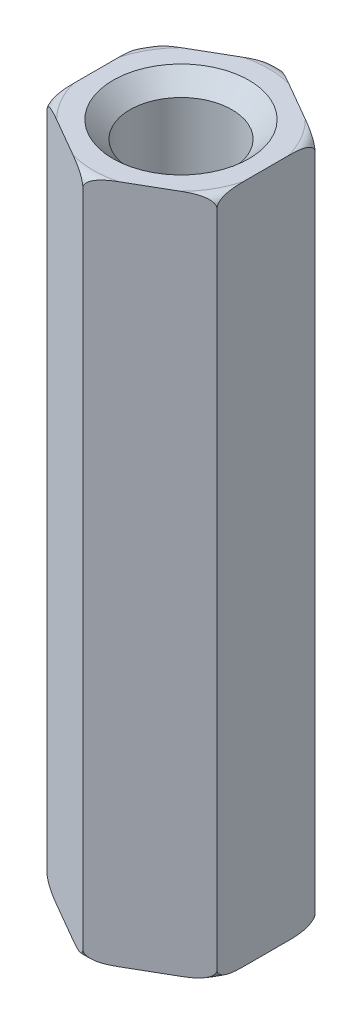
from build123d import *

# Parameters (mm, degrees)
SKETCH2_R           = 1.5
BOSS_EXTRUDE2_DEPTH = 10
CHAMFER1_SIZE       = 0.5


with BuildPart() as part:
    # Sketch2 → Boss-Extrude2 (new, symmetric)
    with BuildSketch(Plane(origin=(0, 0, 0), x_dir=(1, 0, 0), z_dir=(0, 1, 0))):
        Polygon((0, -2.886751346), (2.5, -1.443375673), (2.5, 1.443375673), (0, 2.886751346), (-2.5, 1.443375673), (-2.5, -1.443375673), align=None)
        with Locations(Location((0, 0, 0), (0, 0, 270))):
            Circle(SKETCH2_R, mode=Mode.SUBTRACT)
    extrude(amount=BOSS_EXTRUDE2_DEPTH, both=True)

    # Chamfer1
    chamfer1_edges = [part.edges().sort_by_distance(p)[0] for p in [
        (0, -10, -1.5),
        (0, 10, -1.5),
    ]]
    chamfer(chamfer1_edges, length=CHAMFER1_SIZE)

    # Sketch4 → Cut-Revolve1 (revolve, cut)
    with BuildSketch(Plane(origin=(0, 0, 0), x_dir=(0, 0, -1), z_dir=(1, 0, 0))):
        with BuildLine():
            Line((-2.886751346, 9.7), (-2.886751346, 10))
            Line((-2.886751346, 10), (-2.586751346, 10))
            ThreePointArc((-2.586751346, 10), (-2.79888338, 9.912132034), (-2.886751346, 9.7))
        make_face()
    cut_revolve1 = revolve(axis=Axis((0, 57.75, 0), (0, -1, 0)), mode=Mode.SUBTRACT)

    # Mirror1: Cut-Revolve1 across plane
    add(cut_revolve1.mirror(Plane.ZX), mode=Mode.SUBTRACT)


solid = part.part
